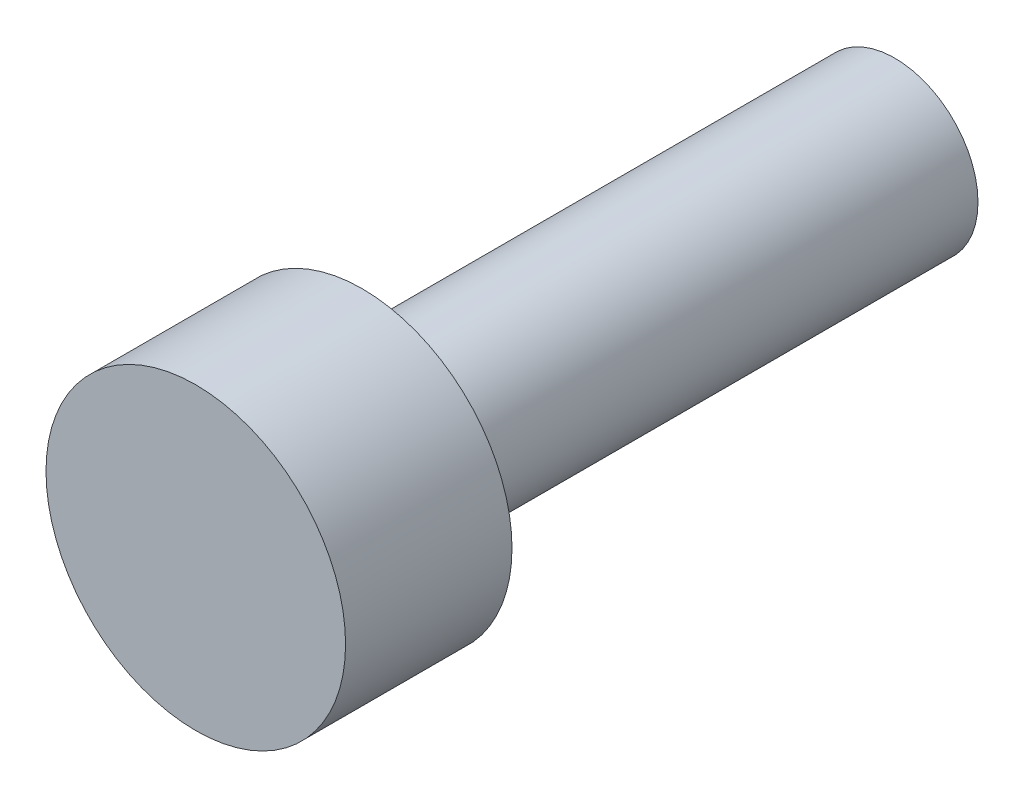
from build123d import *

# Parameters (mm, degrees)
THREAD_ENVELOPE_START = -8
SKETCH1_R             = 1.25
THREAD_ENVELOPE_DEPTH = 8
SKETCH2_R             = 2.25
HEAD_ENVELOPE_DEPTH   = 2.5


with BuildPart() as part:
    # Sketch1 → Thread_Envelope (new body)
    with BuildSketch(Plane.XY.offset(THREAD_ENVELOPE_START)):
        Circle(SKETCH1_R)
    extrude(amount=THREAD_ENVELOPE_DEPTH)

    # Sketch2 → Head_Envelope (add)
    with BuildSketch(Plane.XY):
        Circle(SKETCH2_R)
    extrude(amount=HEAD_ENVELOPE_DEPTH)


solid = part.part
